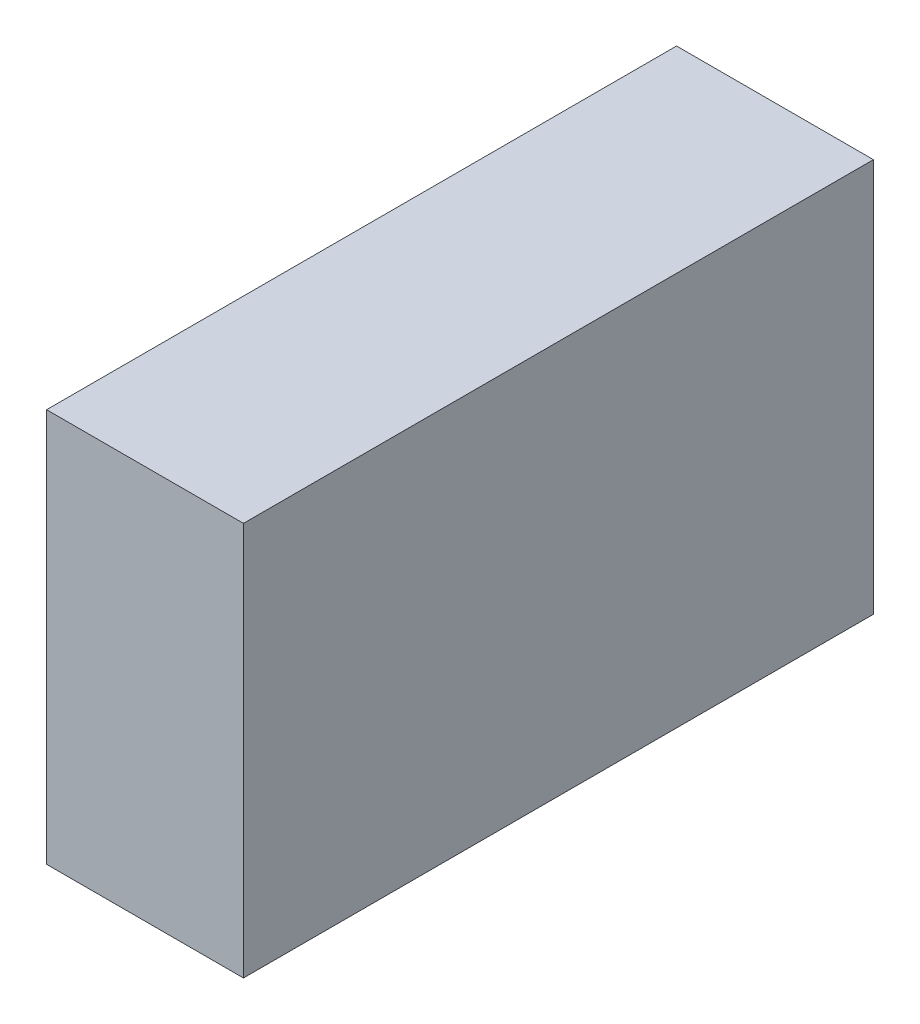
from build123d import *

# Parameters (mm, degrees)
SKETCH1_W      = 31.75
SKETCH1_H      = 63.5
EXTRUDE1_DEPTH = 101.6


with BuildPart() as part:
    # Sketch1 → Extrude1 (new body)
    with BuildSketch(Plane.XY):
        with Locations((0, 31.75)):
            Rectangle(SKETCH1_W, SKETCH1_H)
    extrude(amount=-EXTRUDE1_DEPTH)


solid = part.part
